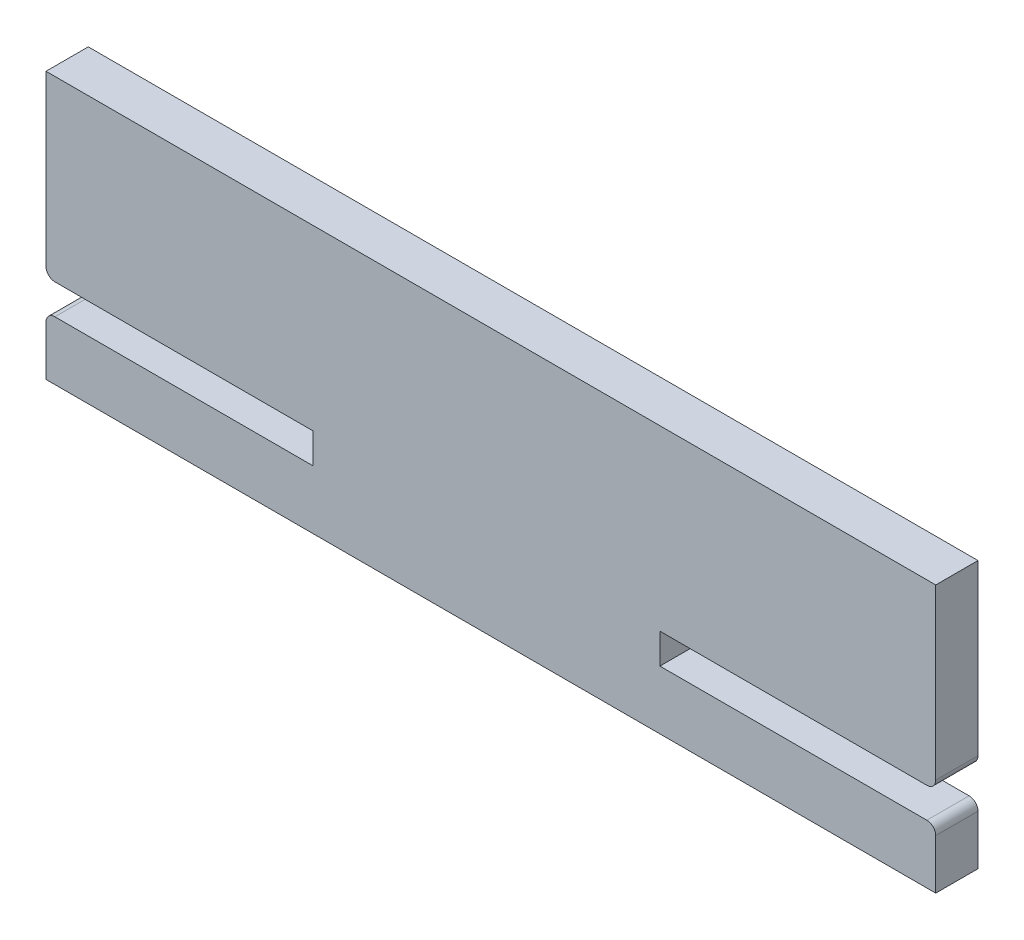
from build123d import *

# Parameters (mm, degrees)
BOSS_EXTRUDE1_DEPTH = 4.75


with BuildPart() as part:
    # Sketch1 → Boss-Extrude1 (new body)
    with BuildSketch(Plane.XY):
        with BuildLine():
            Line((-37.704663212, -5), (-8.704663212, -5))
            Line((-8.704663212, -5), (-8.704663212, -8.4))
            Line((-8.704663212, -8.4), (-37.704663212, -8.4))
            ThreePointArc((-37.704663212, -8.4), (-38.411769994, -8.692893219), (-38.704663212, -9.4))
            Line((-38.704663212, -9.4), (-38.704663212, -15))
            Line((-38.704663212, -15), (61.295336788, -15))
            Line((61.295336788, -15), (61.295336788, -9.4))
            ThreePointArc((61.295336788, -9.4), (61.002443569, -8.692893219), (60.295336788, -8.4))
            Line((60.295336788, -8.4), (30.295336788, -8.4))
            Line((30.295336788, -8.4), (30.295336788, -5))
            Line((30.295336788, -5), (60.295336788, -5))
            ThreePointArc((60.295336788, -5), (61.002443569, -4.707106781), (61.295336788, -4))
            Line((61.295336788, -4), (61.295336788, 15))
            Line((61.295336788, 15), (-38.704663212, 15))
            Line((-38.704663212, 15), (-38.704663212, -4))
            ThreePointArc((-38.704663212, -4), (-38.411769994, -4.707106781), (-37.704663212, -5))
        make_face()
    extrude(amount=BOSS_EXTRUDE1_DEPTH)


solid = part.part
